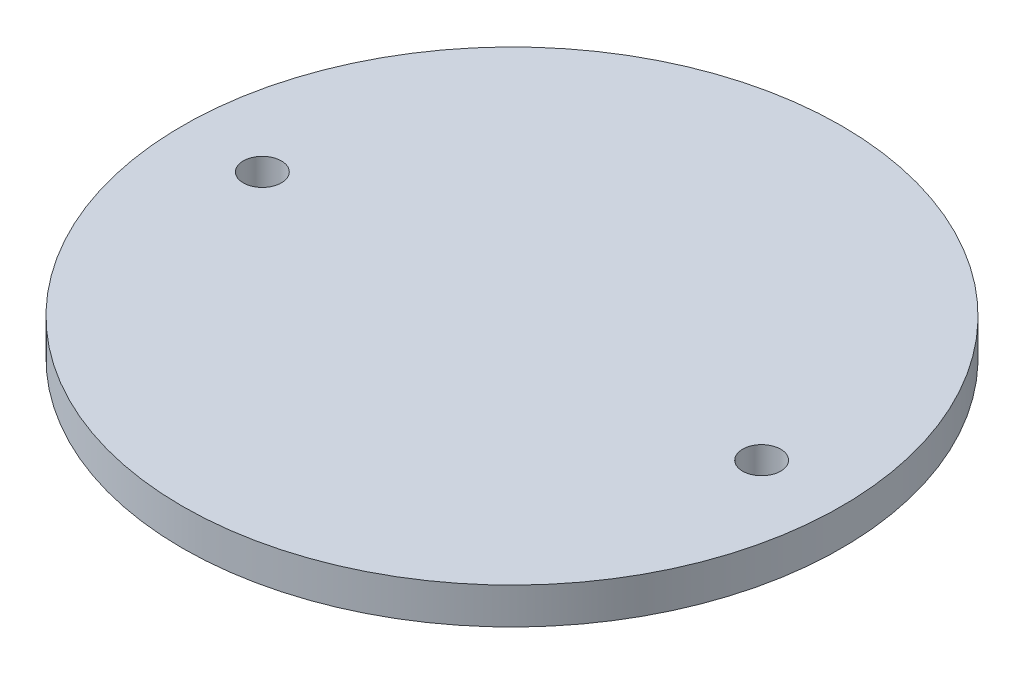
from build123d import *

# Parameters (mm, degrees)
SKETCH1_R           = 36.3
SKETCH1_R_2         = 2.1
BOSS_EXTRUDE1_DEPTH = 4


with BuildPart() as part:
    # Sketch1 → Boss-Extrude1 (new body)
    with BuildSketch(Plane(origin=(0, 0, 0), x_dir=(1, 0, 0), z_dir=(0, 1, 0))):
        with Locations(Location((0, 0, 0), (0, 0, 270))):
            Circle(SKETCH1_R)
        with Locations(Location((-27.5, 0, 0), (0, 0, 270))):
            Circle(SKETCH1_R_2, mode=Mode.SUBTRACT)
        with Locations(Location((27.5, 0, 0), (0, 0, 270))):
            Circle(SKETCH1_R_2, mode=Mode.SUBTRACT)
    extrude(amount=BOSS_EXTRUDE1_DEPTH)


solid = part.part
